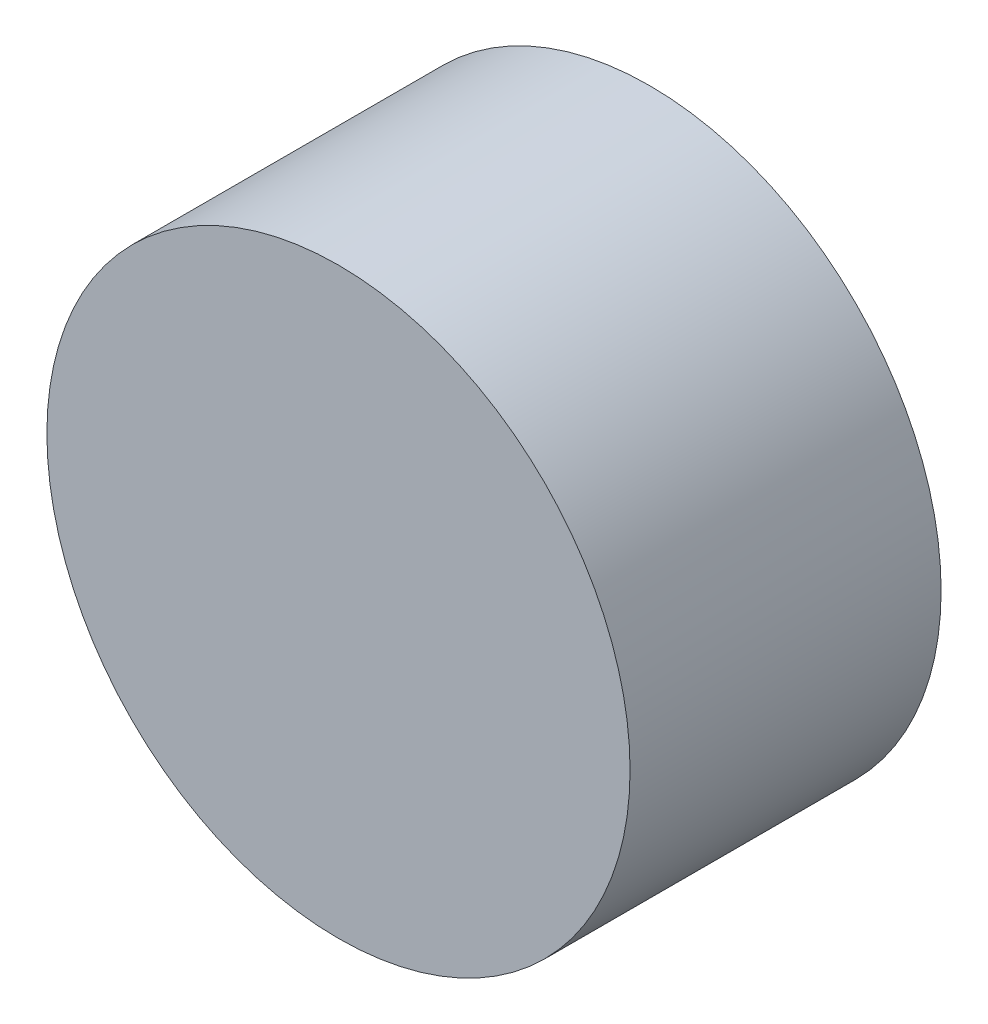
from build123d import *

# Parameters (mm, degrees)
SKIZZE1_R                       = 30
AUFSATZ_LINEAR_AUSTRAGEN1_DEPTH = 32
SKIZZE2_R                       = 14.996636578
AUFSATZ_LINEAR_AUSTRAGEN2_DEPTH = 2
SKIZZE3_R                       = 4.75
AUFSATZ_LINEAR_AUSTRAGEN3_DEPTH = 10
SKIZZE4_R                       = 4
SCHNITT_LINEAR_AUSTRAGEN1_DEPTH = 10


with BuildPart() as part:
    # Skizze1 → Aufsatz-Linear austragen1 (new body)
    with BuildSketch(Plane.XY):
        Circle(SKIZZE1_R)
    extrude(amount=AUFSATZ_LINEAR_AUSTRAGEN1_DEPTH)

    # Skizze2 → Aufsatz-Linear austragen2 (add)
    with BuildSketch(Plane(origin=(0, 0, 0), x_dir=(-1, 0, 0), z_dir=(0, 0, -1))):
        Circle(SKIZZE2_R)
    extrude(amount=AUFSATZ_LINEAR_AUSTRAGEN2_DEPTH)

    # Skizze3 → Aufsatz-Linear austragen3 (add)
    with BuildSketch(Plane(origin=(0, 0, -2), x_dir=(-1, 0, 0), z_dir=(0, 0, -1))):
        Circle(SKIZZE3_R)
    extrude(amount=AUFSATZ_LINEAR_AUSTRAGEN3_DEPTH)

    # Skizze4 → Schnitt-Linear austragen1 (cut)
    with BuildSketch(Plane(origin=(0, 0, -12), x_dir=(-1, 0, 0), z_dir=(0, 0, -1))):
        Circle(SKIZZE4_R)
    extrude(amount=-SCHNITT_LINEAR_AUSTRAGEN1_DEPTH, mode=Mode.SUBTRACT)


solid = part.part
